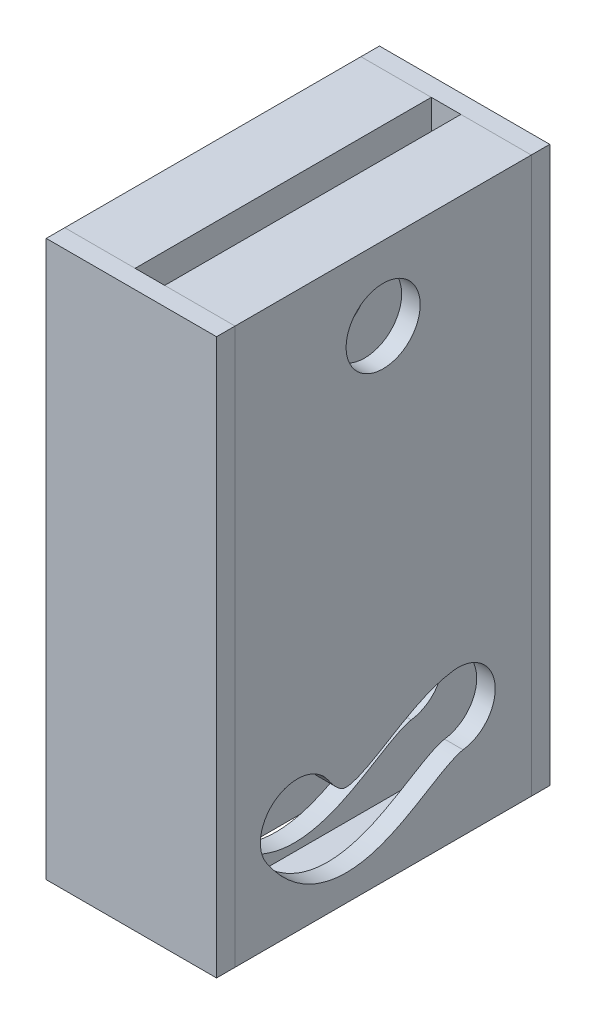
from build123d import *

# Parameters (mm, degrees)
BOSS_EXTRUDE1_DEPTH      = 40
BOSS_EXTRUDE1_DEPTH_BACK = 40
BOSS_EXTRUDE2_START      = 40
SKETCH3_W                = 46
SKETCH3_H                = 150
BOSS_EXTRUDE2_DEPTH      = 5
BOSS_EXTRUDE3_START      = -40
SKETCH3_2_W              = 46
SKETCH3_2_H              = 150
BOSS_EXTRUDE3_DEPTH      = 5
CUT_EXTRUDE1_DEPTH       = 91.437823946
CUT_EXTRUDE1_DEPTH_BACK  = 91.437823946
SKETCH4_R                = 10


with BuildPart() as part:
    # Sketch1 → Boss-Extrude1 (new, two sides: drawn at the far end of the back side and taken through both)
    with BuildSketch(Plane.XY.offset(-BOSS_EXTRUDE1_DEPTH_BACK)):
        Polygon((-4, 75), (-4, 35), (4, 35), (4, 75), (23, 75), (23, -75), (4, -75), (4, -35), (-4, -35), (-4, -75), (-23, -75), (-23, 75), align=None)
        Polygon((-18, 70), (-9, 70), (-9, 30), (9, 30), (9, 70), (18, 70), (18, -70), (9, -70), (9, -30), (-9, -30), (-9, -70), (-18, -70), align=None, mode=Mode.SUBTRACT)
    extrude(amount=BOSS_EXTRUDE1_DEPTH + BOSS_EXTRUDE1_DEPTH_BACK)

    # Sketch4 → Cut-Extrude1 (cut, two sides: drawn at the far end of the back side and taken through both)
    with BuildSketch(Plane(origin=(0, 0, 0), x_dir=(0, 0, -1), z_dir=(1, 0, 0)).offset(-CUT_EXTRUDE1_DEPTH_BACK)):
        with Locations((0, 55)):
            Circle(SKETCH4_R)
        with BuildLine():
            ThreePointArc((-31.461666497, -54.93522817), (-28.765424888, -41.052494967), (-14.882691685, -43.748736575))
            add(Edge.make_bspline(
                [(-14.882691685, -43.748736575), (-14.73199679, -43.972074416), (-14.413200087, -44.428032914), (-13.826955058, -45.205312213), (-13.141934561, -46.011192917), (-12.431766801, -46.714384252), (-11.64427267, -47.357602413), (-10.980525879, -47.718191881), (-10.515141352, -47.854816274), (-9.948010457, -47.912571169), (-8.617850909, -47.781169533), (-5.701911516, -46.79537456), (-0.938472909, -44.150774339), (3.653010738, -41.295212437), (7.722158693, -38.989368531), (11.030232017, -37.352986856), (14.093155969, -36.173235159), (16.770473623, -35.449368836), (18.230602347, -35.183153824), (18.953139382, -35.087139579)],
                knots=[0, 0, 0, 0, 0.015625, 0.03125, 0.0625, 0.09375, 0.125, 0.1875, 0.25, 0.3125, 0.375, 0.5, 0.625, 0.75, 0.8125, 0.875, 0.9375, 0.96875, 1, 1, 1, 1], degree=3))
            ThreePointArc((18.953139382, -35.087139579), (30.18326905, -43.682730753), (21.587677876, -54.912860421))
            add(Edge.make_bspline(
                [(-31.461666497, -54.93522817), (-30.912991679, -55.748393398), (-29.747295483, -57.359027784), (-27.306765579, -60.246877068), (-23.920620543, -63.357845972), (-19.282161629, -66.116795436), (-14.258759815, -67.685998258), (-9.296777514, -68.037086311), (-4.739510469, -67.445444388), (-0.662879327, -66.253951853), (4.217309978, -64.202186553), (8.453831205, -61.802030503), (12.234848175, -59.511672974), (14.835653804, -57.94458288), (17.172414656, -56.626987633), (18.842625084, -55.812055711), (19.955415372, -55.359042224), (20.661379216, -55.118735327), (21.123788931, -54.996992957), (21.420173272, -54.937692867), (21.528293678, -54.920751683), (21.587677876, -54.912860421)],
                knots=[0, 0, 0, 0, 0.03125, 0.0625, 0.125, 0.1875, 0.25, 0.3125, 0.375, 0.4375, 0.5, 0.625, 0.6875, 0.75, 0.8125, 0.875, 0.90625, 0.9375, 0.96875, 0.984375, 1, 1, 1, 1], degree=3))
        make_face()
    extrude(amount=CUT_EXTRUDE1_DEPTH + CUT_EXTRUDE1_DEPTH_BACK, mode=Mode.SUBTRACT)


with BuildPart() as body_2:
    # Sketch3 → Boss-Extrude2 (new body)
    with BuildSketch(Plane.XY.offset(BOSS_EXTRUDE2_START)):
        Rectangle(SKETCH3_W, SKETCH3_H)
    extrude(amount=BOSS_EXTRUDE2_DEPTH)


with BuildPart() as body_3:
    # Sketch3<2> → Boss-Extrude3 (new body)
    with BuildSketch(Plane.XY.offset(BOSS_EXTRUDE3_START)):
        Rectangle(SKETCH3_2_W, SKETCH3_2_H)
    extrude(amount=-BOSS_EXTRUDE3_DEPTH)


solid = Compound([part.part, body_2.part, body_3.part])
